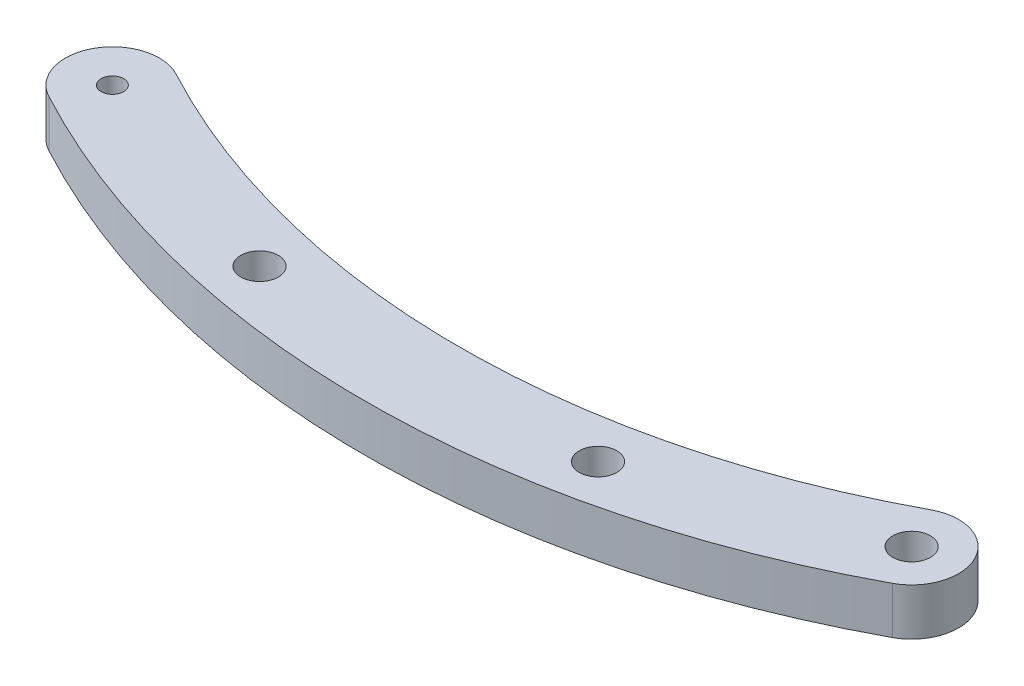
from build123d import *

# Parameters (mm, degrees)
SKETCH1_R           = 2.5
SKETCH1_R_2         = 0.6
SKETCH1_R_3         = 1
BOSS_EXTRUDE1_DEPTH = 2.5
SKETCH2_R           = 1
CUT_EXTRUDE1_DEPTH  = 46.745081512


with BuildPart() as part:
    # Sketch1 → Boss-Extrude1 (new body)
    # profile 1 of 3: a face of its own
    with BuildSketch(Plane(origin=(0, 0, 0), x_dir=(1, 0, 0), z_dir=(0, 1, 0))):
        Circle(SKETCH1_R)
        with Locations(Location((0, 0, 0), (0, 0, 270))):
            Circle(SKETCH1_R_2, mode=Mode.SUBTRACT)
    # profile 2 of 3: a face of its own
    with BuildSketch(Plane(origin=(0, 0, 0), x_dir=(1, 0, 0), z_dir=(0, 1, 0))):
        with BuildLine():
            ThreePointArc((-1.180555556, 2.203698841), (1.284252917, 2.144922946), (2.5, 0))
            ThreePointArc((2.5, 0), (2.144922946, -1.284252917), (1.180555556, -2.203698841))
            ThreePointArc((1.180555556, -2.203698841), (21.25, 2.833420868), (41.319444444, -2.203698841))
            ThreePointArc((41.319444444, -2.203698841), (40.296301159, 1.180555556), (43.680555556, 2.203698841))
            ThreePointArc((43.680555556, 2.203698841), (21.25, 7.833420868), (-1.180555556, 2.203698841))
        make_face()
    # profile 3 of 3: a face of its own
    with BuildSketch(Plane(origin=(0, 0, 0), x_dir=(1, 0, 0), z_dir=(0, 1, 0))):
        with Locations((42.5, 0)):
            Circle(SKETCH1_R)
        with Locations(Location((42.5, 0, 0), (0, 0, 270))):
            Circle(SKETCH1_R_3, mode=Mode.SUBTRACT)
    extrude(amount=BOSS_EXTRUDE1_DEPTH)

    # Sketch2 → Cut-Extrude1 (cut, through all)
    with BuildSketch(Plane(origin=(0, 2.5, 0), x_dir=(1, 0, 0), z_dir=(0, 1, 0))):
        with Locations(Location((12.25, 4.424236239, 0), (0, 0, 270))):
            Circle(SKETCH2_R)
        with Locations(Location((30.25, 4.424236239, 0), (0, 0, 270))):
            Circle(SKETCH2_R)
    extrude(amount=-CUT_EXTRUDE1_DEPTH, mode=Mode.SUBTRACT)


with BuildPart() as body_2:
    # Mirror1: mirrored copy
    add(part.part.mirror(Plane.XY))


solid = body_2.part
